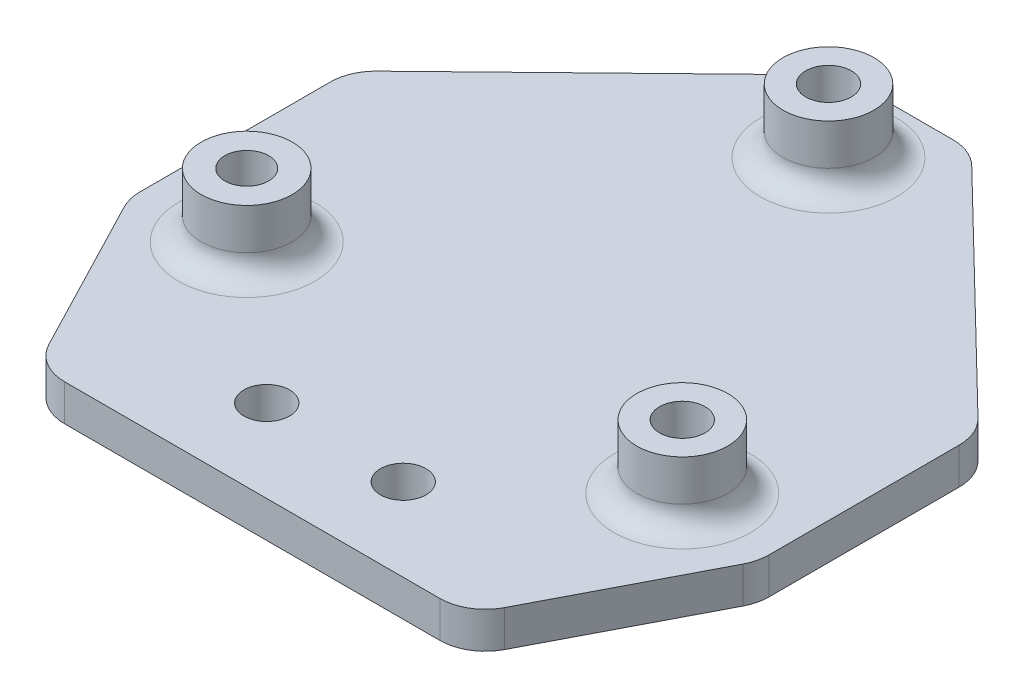
from build123d import *

# Parameters (mm, degrees)
SKETCH1_R           = 2.5
BOSS_EXTRUDE2_DEPTH = 4
FILLET1_R           = 5
SKETCH2_R           = 5
SKETCH2_R_2         = 2.5
SKETCH2_R_3         = 2.410622894
BOSS_EXTRUDE3_DEPTH = 7
FILLET2_R           = 2.5
SKETCH3_R           = 2.5
CUT_EXTRUDE1_DEPTH  = 80.510690177


with BuildPart() as part:
    # Sketch1 → Boss-Extrude2 (new body)
    with BuildSketch(Plane(origin=(0, 0, 0), x_dir=(1, 0, 0), z_dir=(0, 1, 0))):
        Polygon((-2.997842525, 1.627546264), (-2.997842525, -22.606832334), (7.911575214, -43.612950039), (31.557320362, -43.612950039), (55.203065509, -43.612950039), (66.112483248, -22.606832334), (66.112483248, 1.627546264), (38.728999177, 28.237162663), (24.385641546, 28.237162663), align=None)
        with Locations(Location((55.490124242, -20.289109104, 0), (0, 0, 270))):
            Circle(SKETCH1_R, mode=Mode.SUBTRACT)
        with Locations(Location((31.557320362, 19.710890896, 0), (0, 0, 270))):
            Circle(SKETCH1_R, mode=Mode.SUBTRACT)
        with Locations(Location((7.624516482, -20.289109104, 0), (0, 0, 270))):
            Circle(SKETCH1_R, mode=Mode.SUBTRACT)
    extrude(amount=BOSS_EXTRUDE2_DEPTH)

    # Fillet1
    fillet1_edges = [part.edges().sort_by_distance(p)[0] for p in [
        (24.385641546, 2, -28.237162663),
        (38.728999177, 2, -28.237162663),
        (66.112483248, 2, -1.627546264),
        (66.112483248, 2, 22.606832334),
        (55.203065509, 2, 43.612950039),
        (7.911575214, 2, 43.612950039),
        (-2.997842525, 2, 22.606832334),
        (-2.997842525, 2, -1.627546264),
    ]]
    fillet(fillet1_edges, radius=FILLET1_R)

    # Sketch2 → Boss-Extrude3 (add)
    # profile 1 of 3: a face of its own
    with BuildSketch(Plane(origin=(0, 4, 0), x_dir=(1, 0, 0), z_dir=(0, 1, 0))):
        with Locations(Location((31.557320362, 19.710890896, 0), (0, 0, 270))):
            Circle(SKETCH2_R)
        with Locations(Location((31.557320362, 19.710890896, 0), (0, 0, 270))):
            Circle(SKETCH2_R_2, mode=Mode.SUBTRACT)
    # profile 2 of 3: a face of its own
    with BuildSketch(Plane(origin=(0, 4, 0), x_dir=(1, 0, 0), z_dir=(0, 1, 0))):
        with Locations(Location((55.490124242, -20.289109104, 0), (0, 0, 270))):
            Circle(SKETCH2_R)
        with Locations(Location((55.490124242, -20.289109104, 0), (0, 0, 270))):
            Circle(SKETCH2_R_2, mode=Mode.SUBTRACT)
    # profile 3 of 3: a face of its own
    with BuildSketch(Plane(origin=(0, 4, 0), x_dir=(1, 0, 0), z_dir=(0, 1, 0))):
        with Locations(Location((7.624516482, -20.289109104, 0), (0, 0, 270))):
            Circle(SKETCH2_R)
        with Locations(Location((7.624516482, -20.289109104, 0), (0, 0, 270))):
            Circle(SKETCH2_R_3, mode=Mode.SUBTRACT)
    extrude(amount=BOSS_EXTRUDE3_DEPTH)

    # Fillet2
    fillet2_edges = [part.edges().sort_by_distance(p)[0] for p in [
        (55.490124242, 4, 15.289109104),
        (7.624516482, 4, 15.289109104),
        (31.557320362, 4, -24.710890896),
    ]]
    fillet(fillet2_edges, radius=FILLET2_R)

    # Sketch3 → Cut-Extrude1 (cut, through all)
    with BuildSketch(Plane(origin=(0, 4, 0), x_dir=(1, 0, 0), z_dir=(0, 1, 0))):
        with Locations(Location((39.057320362, -34.521990264, 0), (0, 0, 270))):
            Circle(SKETCH3_R)
        with Locations(Location((24.057320362, -34.521990264, 0), (0, 0, 270))):
            Circle(SKETCH3_R)
    extrude(amount=-CUT_EXTRUDE1_DEPTH, mode=Mode.SUBTRACT)


solid = part.part
